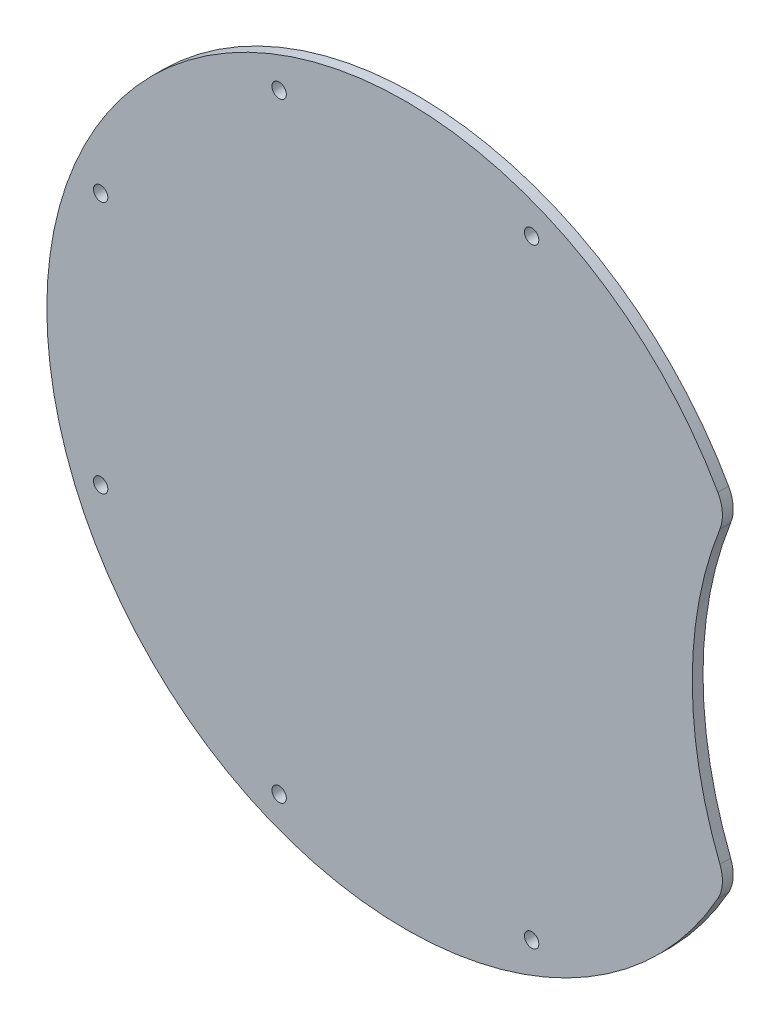
from build123d import *

# Parameters (mm, degrees)
CROQUIS1_R              = 100
SALIENTE_EXTRUIR1_DEPTH = 3
CROQUIS3_R              = 110
CORTAR_EXTRUIR1_DEPTH   = 3
REDONDEO1_R             = 10
CROQUIS4_R              = 2
CORTAR_EXTRUIR2_DEPTH   = 142.453172607


with BuildPart() as part:
    # Croquis1 → Saliente-Extruir1 (new body)
    with BuildSketch(Plane.XY):
        Circle(CROQUIS1_R)
    extrude(amount=SALIENTE_EXTRUIR1_DEPTH)

    # Croquis3 → Cortar-Extruir1 (cut)
    with BuildSketch(Plane.XY.offset(3)):
        with Locations((190, 0)):
            Circle(CROQUIS3_R)
    extrude(amount=-CORTAR_EXTRUIR1_DEPTH, mode=Mode.SUBTRACT)

    # Redondeo1
    redondeo1_edges = [part.edges().sort_by_distance(p)[0] for p in [
        (89.473684211, -44.659375654, 1.5),
        (89.473684211, 44.659375654, 1.5),
    ]]
    fillet(redondeo1_edges, radius=REDONDEO1_R)

    # Croquis4 → Cortar-Extruir2 (cut, through all)
    with BuildSketch(Plane(origin=(0, 0, 0), x_dir=(-1, 0, 0), z_dir=(0, 0, -1))):
        with Locations((-35.206875778, 84.996916991)):
            Circle(CROQUIS4_R)
        with Locations((35.206875778, 84.996916991)):
            Circle(CROQUIS4_R)
        with Locations((84.996916991, 35.206875778)):
            Circle(CROQUIS4_R)
        with Locations((84.996916991, -35.206875778)):
            Circle(CROQUIS4_R)
        with Locations((35.206875778, -84.996916991)):
            Circle(CROQUIS4_R)
        with Locations((-35.206875778, -84.996916991)):
            Circle(CROQUIS4_R)
    extrude(amount=-CORTAR_EXTRUIR2_DEPTH, mode=Mode.SUBTRACT)


solid = part.part
